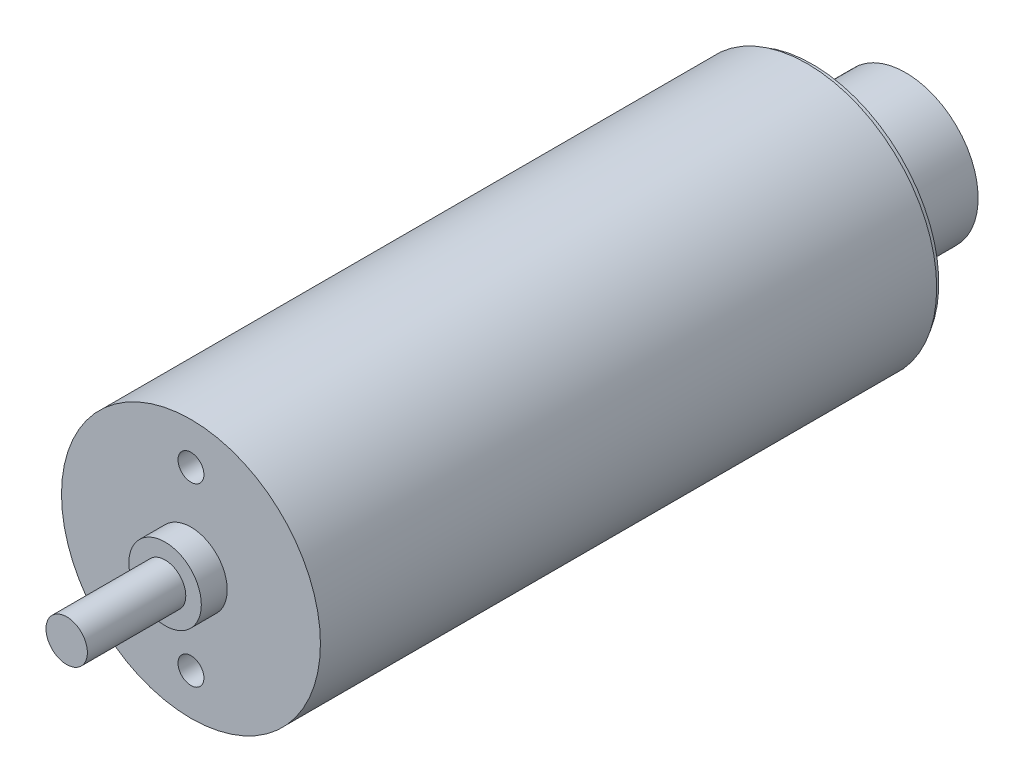
from build123d import *

# Parameters (mm, degrees)
SKETCH1_R                 = 12.5
BOSS_EXTRUDE1_DEPTH       = 60
SKETCH2_R                 = 3.5
BOSS_EXTRUDE2_DEPTH       = 2.5
SKETCH2_3_R               = 2
BOSS_EXTRUDE3_DEPTH       = 12
M3X0_5_TAPPED_HOLE1_D     = 2.5
M3X0_5_TAPPED_HOLE1_DEPTH = 4.99999
M3X0_5_TAPPED_HOLE1_TIP   = 0.751075774
CUT_EXTRUDE1_START        = -0.5
SKETCH6_R                 = 12.5
SKETCH6_R_2               = 12.2
CUT_EXTRUDE1_DEPTH        = 0.5
SKETCH5_R                 = 7
BOSS_EXTRUDE4_DEPTH       = 9


with BuildPart() as part:
    # Sketch1 → Boss-Extrude1 (new body)
    with BuildSketch(Plane.XY):
        Circle(SKETCH1_R)
    extrude(amount=-BOSS_EXTRUDE1_DEPTH)

    # Sketch2 → Boss-Extrude2 (add)
    with BuildSketch(Plane.XY):
        Circle(SKETCH2_R)
    extrude(amount=BOSS_EXTRUDE2_DEPTH)

    # Sketch2<3> → Boss-Extrude3 (add)
    with BuildSketch(Plane.XY):
        Circle(SKETCH2_3_R)
    extrude(amount=BOSS_EXTRUDE3_DEPTH)

    # M3x0.5 Tapped Hole1
    with Locations(Plane.XY):
        with Locations((0, 8.5), (0, -8.5)):
            Hole(M3X0_5_TAPPED_HOLE1_D / 2, depth=M3X0_5_TAPPED_HOLE1_DEPTH)
            with Locations((0, 0, -(M3X0_5_TAPPED_HOLE1_DEPTH + M3X0_5_TAPPED_HOLE1_TIP / 2))):  # 118° drill point
                Cone(0, M3X0_5_TAPPED_HOLE1_D / 2, M3X0_5_TAPPED_HOLE1_TIP, mode=Mode.SUBTRACT)

    # Sketch6 → Cut-Extrude1 (cut)
    with BuildSketch(Plane(origin=(0, 0, -60), x_dir=(-1, 0, 0), z_dir=(0, 0, -1)).offset(CUT_EXTRUDE1_START)):
        Circle(SKETCH6_R)
        Circle(SKETCH6_R_2, mode=Mode.SUBTRACT)
    extrude(amount=CUT_EXTRUDE1_DEPTH, mode=Mode.SUBTRACT)

    # Sketch5 → Boss-Extrude4 (add)
    with BuildSketch(Plane(origin=(0, 0, -60), x_dir=(-1, 0, 0), z_dir=(0, 0, -1))):
        Circle(SKETCH5_R)
    extrude(amount=BOSS_EXTRUDE4_DEPTH)


solid = part.part
